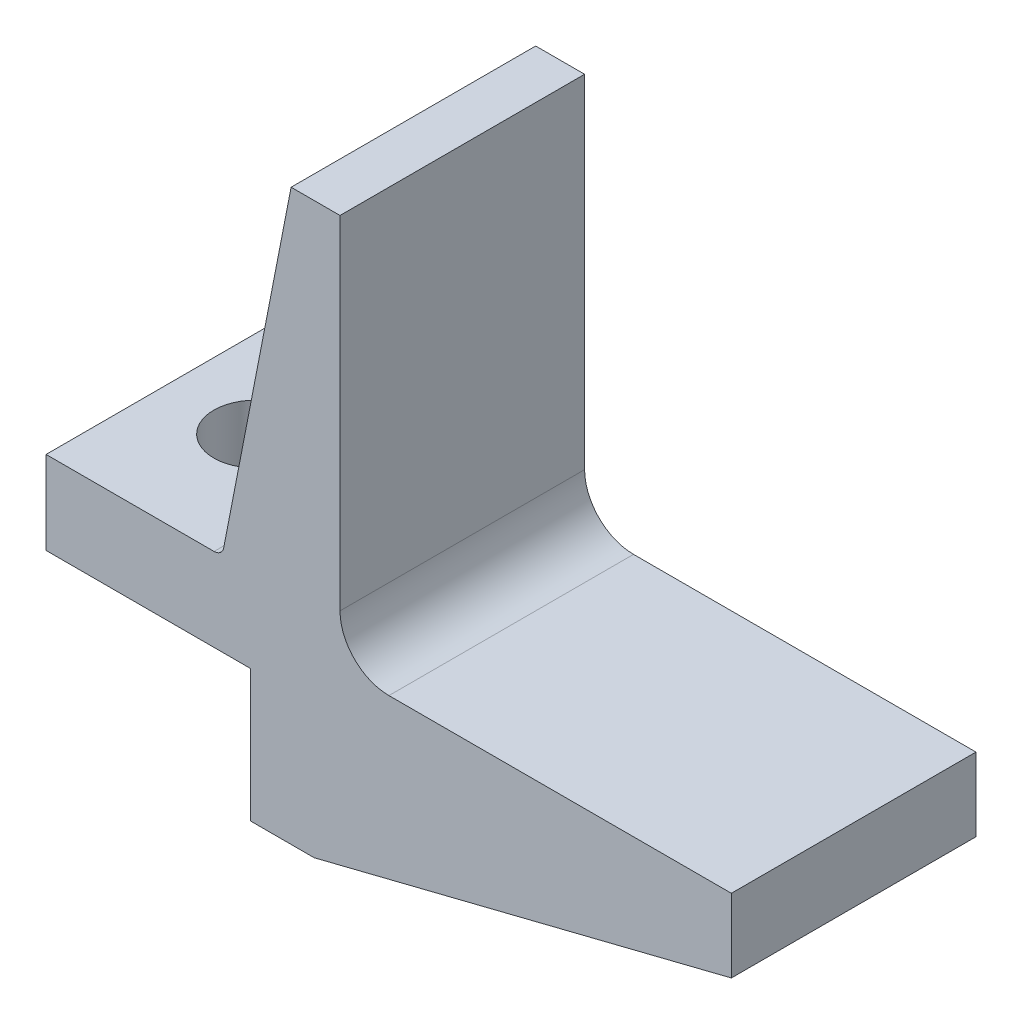
from build123d import *

# Parameters (mm, degrees)
BOSS_EXTRUDE1_DEPTH          = 31.75
F_3_8_0_375_DIAMETER_HOLE1_D = 10.795
FILLET1_R                    = 1.27
FILLET2_R                    = 6.35


with BuildPart() as part:
    # Sketch1 → Boss-Extrude1 (new body)
    with BuildSketch(Plane.XY):
        Polygon((0, 0), (50.8, 0), (50.8, -9.525), (-3.3628076, -23.086314), (-11.6178076, -23.086314), (-11.6178076, -5.941314), (-38.1608076, -5.941314), (-38.1608076, 4.853686), (-15.3008076, 4.853686), (-6.35, 50.8), (0, 50.8), align=None)
    extrude(amount=BOSS_EXTRUDE1_DEPTH)

    # 3/8 (0.375) Diameter Hole1 (through all)
    with Locations(Plane(origin=(0, 4.853686, 0), x_dir=(1, 0, 0), z_dir=(0, 1, 0))):
        with Locations((-26.8578076, -15.875)):
            Hole(F_3_8_0_375_DIAMETER_HOLE1_D / 2)

    # Fillet1
    fillet1_edges = [part.edges().sort_by_distance(p)[0] for p in [
        (-15.3008076, 4.853686, 15.875),
    ]]
    fillet(fillet1_edges, radius=FILLET1_R)

    # Fillet2
    fillet2_edges = [part.edges().sort_by_distance(p)[0] for p in [
        (0, 0, 15.875),
    ]]
    fillet(fillet2_edges, radius=FILLET2_R)


solid = part.part
